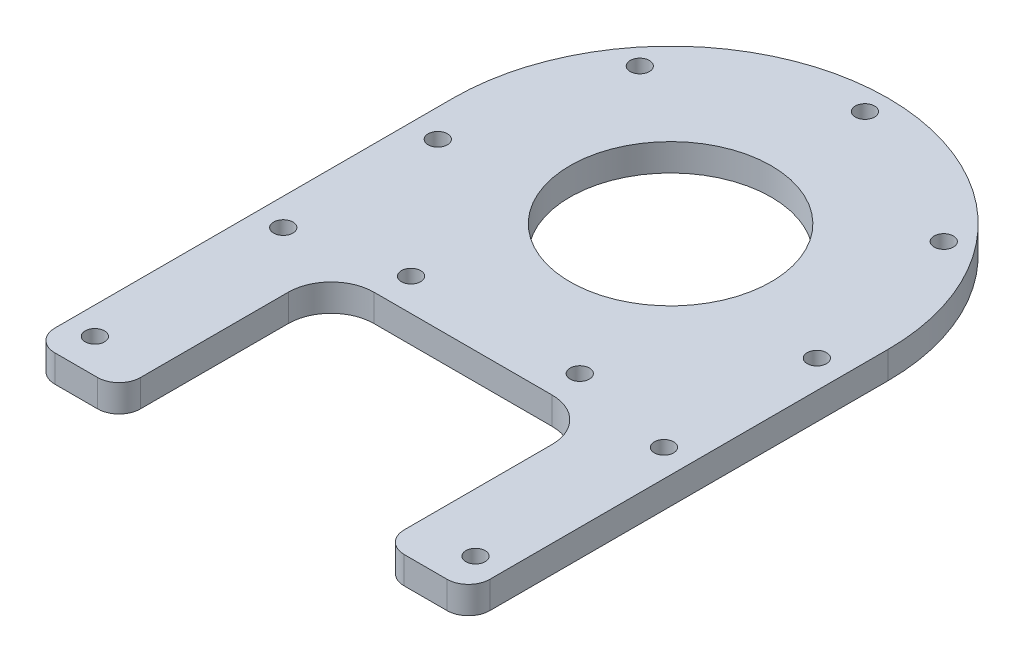
from build123d import *

# Parameters (mm, degrees)
BOSS_EXTRUDE1_DEPTH                             = 6.35
FILLET1_R                                       = 10
CSK_FOR_M4_FLAT_HEAD_MACHINE_SCREW1_D           = 4.5
CSK_FOR_M4_FLAT_HEAD_MACHINE_SCREW1_DEPTH       = 41.15
CSK_FOR_M4_FLAT_HEAD_MACHINE_SCREW1_CSINK_D     = 9.4
CSK_FOR_M4_FLAT_HEAD_MACHINE_SCREW1_CSINK_ANGLE = 90
CSK_FOR_M4_FLAT_HEAD_MACHINE_SCREW1_TIP         = 1.351936393
SKETCH5_R                                       = 23.5
CUT_EXTRUDE1_DEPTH                              = 91.971053662
FILLET2_R                                       = 5


with BuildPart() as part:
    # Sketch1 → Boss-Extrude1 (new body)
    with BuildSketch(Plane(origin=(0, 0, 0), x_dir=(1, 0, 0), z_dir=(0, 1, 0))):
        with BuildLine():
            ThreePointArc((-15.208520638, -24.071794541), (-40.946506862, -5.668779355), (-50.8, 24.398205459))
            Line((-50.8, 24.398205459), (-50.8, -73.601794541))
            Line((-50.8, -73.601794541), (-30.8, -73.601794541))
            Line((-30.8, -73.601794541), (-30.8, -24.071794541))
            Line((-30.8, -24.071794541), (-15.208520638, -24.071794541))
        make_face()
        with BuildLine():
            Line((0, 24.398205459), (-50.8, 24.398205459))
            ThreePointArc((-50.8, 24.398205459), (-40.946506862, -5.668779355), (-15.208520638, -24.071794541))
            Line((-15.208520638, -24.071794541), (0, -24.071794541))
            Line((0, -24.071794541), (0, 24.398205459))
        make_face()
        with BuildLine():
            Line((50.8, 24.398205459), (0, 24.398205459))
            Line((0, 24.398205459), (0, -24.071794541))
            Line((0, -24.071794541), (15.208520638, -24.071794541))
            ThreePointArc((15.208520638, -24.071794541), (40.946506862, -5.668779355), (50.8, 24.398205459))
        make_face()
        with BuildLine():
            ThreePointArc((50.8, 24.398205459), (0, 75.198205459), (-50.8, 24.398205459))
            Line((-50.8, 24.398205459), (0, 24.398205459))
            Line((0, 24.398205459), (50.8, 24.398205459))
        make_face()
        with BuildLine():
            Line((50.8, -73.601794541), (50.8, 24.398205459))
            ThreePointArc((50.8, 24.398205459), (40.946506862, -5.668779355), (15.208520638, -24.071794541))
            Line((15.208520638, -24.071794541), (30.8, -24.071794541))
            Line((30.8, -24.071794541), (30.8, -73.601794541))
            Line((30.8, -73.601794541), (50.8, -73.601794541))
        make_face()
    extrude(amount=BOSS_EXTRUDE1_DEPTH)

    # Fillet1
    fillet1_edges = [part.edges().sort_by_distance(p)[0] for p in [
        (-30.8, 3.175, 24.071794541),
        (30.8, 3.175, 24.071794541),
    ]]
    fillet(fillet1_edges, radius=FILLET1_R)

    # CSK for M4 Flat Head Machine Screw1
    with Locations(Plane.XZ):
        with Locations((44.261727213, -14.295755058), (-44.45, 65.601794541), (44.45, 65.601794541), (-44.45, 21.601794541), (44.45, 21.601794541), (19.698321756, 16.505781144), (-19.698321756, 16.505781144), (-44.261727213, -14.295755058), (-35.495149304, -52.704642464), (0, -69.798205459), (35.495149304, -52.704642464)):
            CounterSinkHole(CSK_FOR_M4_FLAT_HEAD_MACHINE_SCREW1_D / 2, CSK_FOR_M4_FLAT_HEAD_MACHINE_SCREW1_CSINK_D / 2, depth=CSK_FOR_M4_FLAT_HEAD_MACHINE_SCREW1_DEPTH, counter_sink_angle=CSK_FOR_M4_FLAT_HEAD_MACHINE_SCREW1_CSINK_ANGLE)
            with Locations((0, 0, -(CSK_FOR_M4_FLAT_HEAD_MACHINE_SCREW1_DEPTH + CSK_FOR_M4_FLAT_HEAD_MACHINE_SCREW1_TIP / 2))):  # 118° drill point
                Cone(0, CSK_FOR_M4_FLAT_HEAD_MACHINE_SCREW1_D / 2, CSK_FOR_M4_FLAT_HEAD_MACHINE_SCREW1_TIP, mode=Mode.SUBTRACT)

    # Sketch5 → Cut-Extrude1 (cut, through all)
    with BuildSketch(Plane.XZ):
        with Locations(Location((0, -24.398205459, 0), (0, 0, 270))):
            Circle(SKETCH5_R)
    extrude(amount=-CUT_EXTRUDE1_DEPTH, mode=Mode.SUBTRACT)

    # Fillet2
    fillet2_edges = [part.edges().sort_by_distance(p)[0] for p in [
        (-30.8, 3.175, 73.601794541),
        (-50.8, 3.175, 73.601794541),
        (50.8, 3.175, 73.601794541),
        (30.8, 3.175, 73.601794541),
    ]]
    fillet(fillet2_edges, radius=FILLET2_R)


solid = part.part
